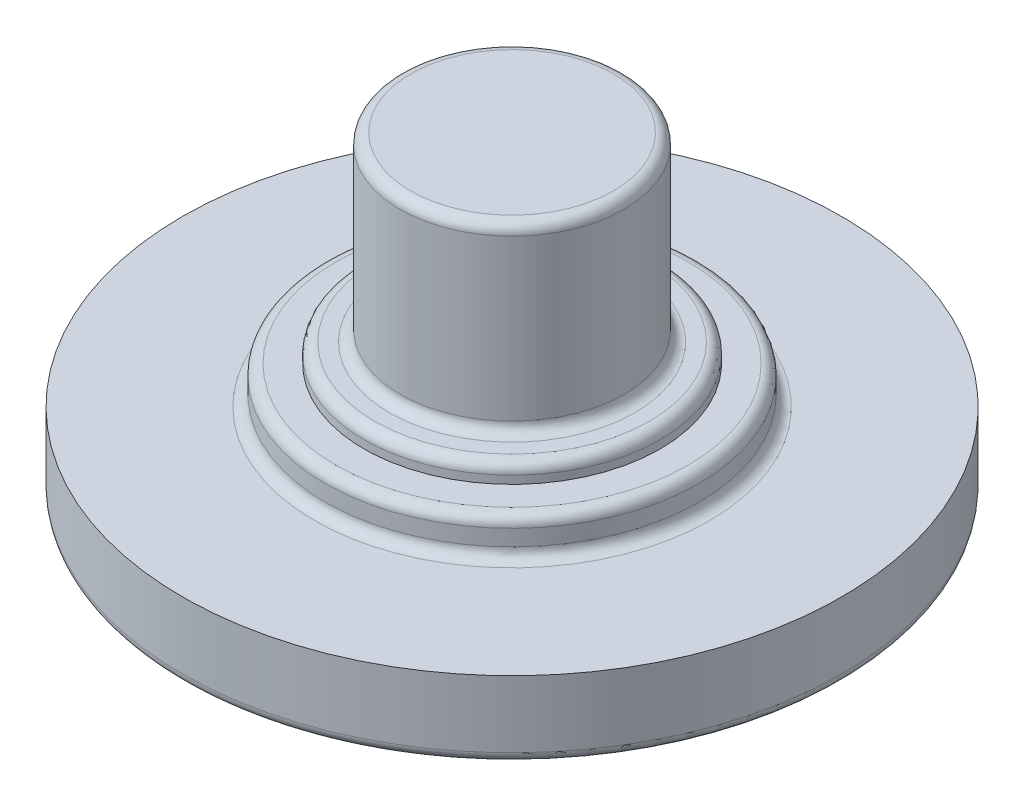
from build123d import *

# Parameters (mm, degrees)
FILETE4_R  = 2
FILETE5_R  = 2
FILETE6_R  = 2
FILETE7_R  = 2
FILETE9_R  = 3
FILETE10_R = 0.5


with BuildPart() as part:
    # Esboço1 → Revolução1 (revolve)
    with BuildSketch(Plane.XY, mode=Mode.PRIVATE) as revolu_o1_sk:
        Polygon((0, 52.954282397), (21, 52.954282397), (21, 18.954282397), (27.75, 18.954282397), (27.75, 15.454282397), (35, 15.454282397), (35, 8.454282397), (61.75, 8.454282397), (61.75, -6.045717603), (34, -6.045717603), (34, -11.745717603), (30, -11.745717603), (30, -26.545717603), (23, -26.545717603), (23, -22.545717603), (19.634071962, -9.045717603), (0, -9.045717603), align=None)
    revolve(revolu_o1_sk.sketch.rotate(Axis((0, 52.954282397, 0), (0, -1, 0)), 180), axis=Axis((0, 52.954282397, 0), (0, -1, 0)))

    # Filete4
    filete4_edges = [part.edges().sort_by_distance(p)[0] for p in [
        (21, 52.954282397, 0),
    ]]
    fillet(filete4_edges, radius=FILETE4_R)

    # Filete5
    filete5_edges = [part.edges().sort_by_distance(p)[0] for p in [
        (27.75, 18.954282397, 0),
        (21, 18.954282397, 0),
    ]]
    fillet(filete5_edges, radius=FILETE5_R)

    # Filete6
    filete6_edges = [part.edges().sort_by_distance(p)[0] for p in [
        (61.75, -6.045717603, 0),
        (35, 8.454282397, 0),
        (35, 15.454282397, 0),
    ]]
    fillet(filete6_edges, radius=FILETE6_R)

    # Filete7
    filete7_edges = [part.edges().sort_by_distance(p)[0] for p in [
        (34, -6.045717603, 0),
    ]]
    fillet(filete7_edges, radius=FILETE7_R)

    # Filete9
    filete9_edges = [part.edges().sort_by_distance(p)[0] for p in [
        (19.634071962, -9.045717603, 0),
        (23, -26.545717603, 0),
        (30, -11.745717603, 0),
    ]]
    fillet(filete9_edges, radius=FILETE9_R)

    # Filete10
    filete10_edges = [part.edges().sort_by_distance(p)[0] for p in [
        (30, -26.545717603, 0),
    ]]
    fillet(filete10_edges, radius=FILETE10_R)


solid = part.part
